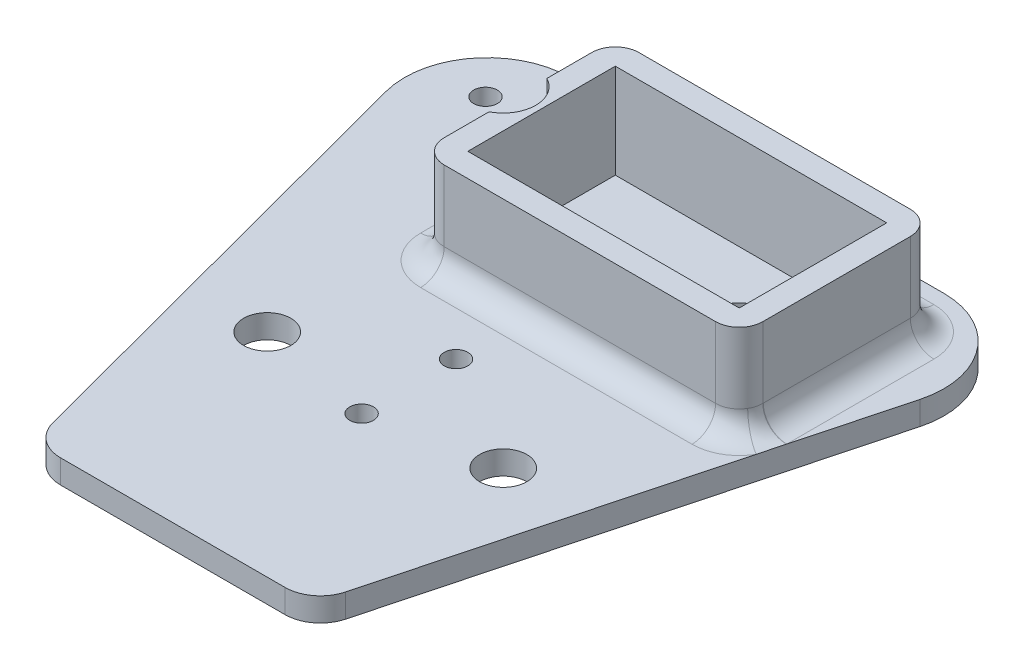
from build123d import *

# Parameters (mm, degrees)
SKETCH1_R               = 3
SKETCH1_R_2             = 2
BOSS_EXTRUDE1_DEPTH     = 2
FILLET1_R               = 7
SKETCH3_W               = 27
SKETCH3_H               = 16.5
SKETCH3_W_2             = 23
SKETCH3_H_2             = 12.5
BOSS_EXTRUDE2_DEPTH     = 8
FILLET2_R               = 2
FILLET3_R               = 2
SKETCH2_R               = 1
CUT_EXTRUDE1_DEPTH      = 2
CUT_EXTRUDE2_DEPTH      = 45.635758586
CUT_EXTRUDE2_DEPTH_BACK = 45.635758586
SKETCH4_R               = 2
SKETCH5_R               = 2.75
CUT_EXTRUDE3_DEPTH      = 45.635758586
FILLET4_R               = 3


with BuildPart() as part:
    # Sketch1 → Boss-Extrude1 (new body)
    with BuildSketch(Plane(origin=(0, 0, 0), x_dir=(1, 0, 0), z_dir=(0, 1, 0))):
        Polygon((15, 0), (24.948794511, 37.5), (-24.948794511, 37.5), (-15, 0), (-11.816385757, -12), (11.816385757, -12), align=None)
        with Locations(Location((10, 26, 0), (0, 0, 270))):
            Circle(SKETCH1_R, mode=Mode.SUBTRACT)
        with Locations(Location((10, 6, 0), (0, 0, 270))):
            Circle(SKETCH1_R_2, mode=Mode.SUBTRACT)
        with Locations(Location((-10, 6, 0), (0, 0, 90))):
            Circle(SKETCH1_R_2, mode=Mode.SUBTRACT)
    extrude(amount=BOSS_EXTRUDE1_DEPTH)

    # Fillet1
    fillet1_edges = [part.edges().sort_by_distance(p)[0] for p in [
        (-24.948794511, 1, -37.5),
        (24.948794511, 1, -37.5),
    ]]
    fillet(fillet1_edges, radius=FILLET1_R)

    # Sketch3 → Boss-Extrude2 (add)
    with BuildSketch(Plane(origin=(0, 2, 0), x_dir=(1, 0, 0), z_dir=(0, 1, 0))):
        with Locations((4.75, 26)):
            Rectangle(SKETCH3_W, SKETCH3_H)
        with Locations((4.75, 26)):
            Rectangle(SKETCH3_W_2, SKETCH3_H_2, mode=Mode.SUBTRACT)
    extrude(amount=BOSS_EXTRUDE2_DEPTH)

    # Fillet2
    fillet2_edges = [part.edges().sort_by_distance(p)[0] for p in [
        (-8.75, 6, -34.25),
        (-8.75, 6, -17.75),
        (18.25, 6, -17.75),
        (18.25, 6, -34.25),
    ]]
    fillet(fillet2_edges, radius=FILLET2_R)

    # Fillet3
    fillet3_edges = [part.edges().sort_by_distance(p)[0] for p in [
        (4.75, 2, -17.75),
        (-8.75, 2, -26),
        (18.25, 2, -26),
        (4.75, 2, -34.25),
        (-8.164213562, 2, -18.335786438),
        (17.664213562, 2, -18.335786438),
        (17.664213562, 2, -33.664213562),
        (-8.164213562, 2, -33.664213562),
    ]]
    fillet(fillet3_edges, radius=FILLET3_R)

    # Sketch2 → Cut-Extrude1 (cut)
    with BuildSketch(Plane(origin=(0, 2, 0), x_dir=(1, 0, 0), z_dir=(0, 1, 0))):
        with Locations(Location((0, 34.5, 0), (0, 0, 270))):
            Circle(SKETCH2_R)
        with Locations(Location((18, 32.5, 0), (0, 0, 270))):
            Circle(SKETCH2_R)
        with Locations(Location((0, 4, 0), (0, 0, 270))):
            Circle(SKETCH2_R)
        with Locations(Location((0, 12, 0), (0, 0, 270))):
            Circle(SKETCH2_R)
        with Locations(Location((-18, 32.5, 0), (0, 0, 90))):
            Circle(SKETCH2_R)
    extrude(amount=-CUT_EXTRUDE1_DEPTH, mode=Mode.SUBTRACT)

    # Sketch4 → Cut-Extrude2 (cut, two sides: drawn at the far end of the back side and taken through both)
    with BuildSketch(Plane(origin=(0, 2, 0), x_dir=(1, 0, 0), z_dir=(0, 1, 0)).offset(-CUT_EXTRUDE2_DEPTH_BACK)):
        with Locations(Location((-10, 26, 0), (0, 0, 270))):
            Circle(SKETCH4_R)
    extrude(amount=CUT_EXTRUDE2_DEPTH + CUT_EXTRUDE2_DEPTH_BACK, mode=Mode.SUBTRACT)

    # Sketch5 → Cut-Extrude3 (cut, through all)
    with BuildSketch(Plane(origin=(0, 2, 0), x_dir=(1, 0, 0), z_dir=(0, 1, 0))):
        with Locations((-10, 26)):
            Circle(SKETCH5_R)
    extrude(amount=CUT_EXTRUDE3_DEPTH, mode=Mode.SUBTRACT)

    # Fillet4
    fillet4_edges = [part.edges().sort_by_distance(p)[0] for p in [
        (11.816385757, 1, 12),
        (-11.816385757, 1, 12),
    ]]
    fillet(fillet4_edges, radius=FILLET4_R)


solid = part.part
